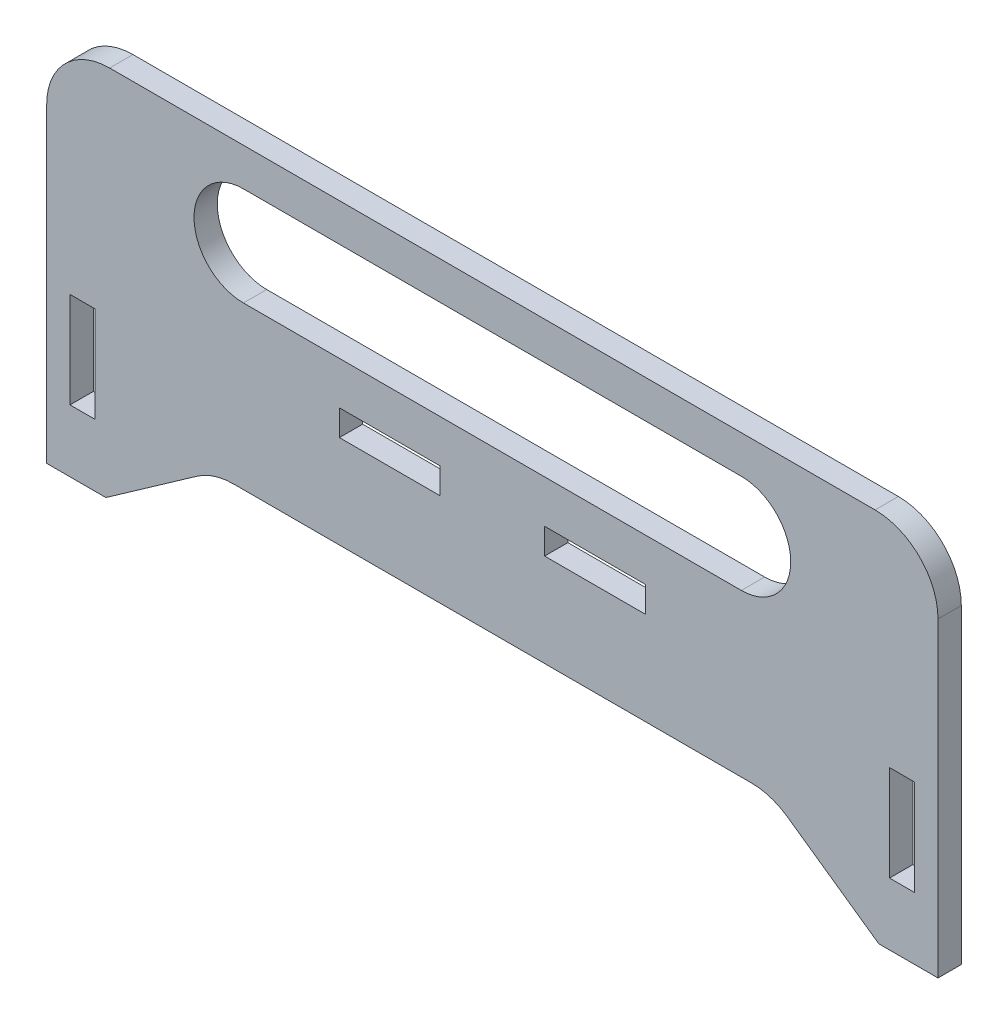
from build123d import *

# Parameters (mm, degrees)
SKETCH1_W           = 16
SKETCH1_H           = 4.1
SKETCH1_W_2         = 4
SKETCH1_H_2         = 15.2
BOSS_EXTRUDE2_DEPTH = 3.7
FILLET1_R           = 10
FILLET2_R           = 10


with BuildPart() as part:
    # Sketch1 → Boss-Extrude2 (new body)
    with BuildSketch(Plane.XY):
        Polygon((-110.178290248, 0), (31.421709752, 0), (31.421709752, -59.4), (22.021709752, -59.4), (4.921709752, -47.383344891), (-83.678290248, -47.383344891), (-100.778290248, -59.4), (-110.178290248, -59.4), align=None)
        with BuildLine():
            Line((0.171709752, -21.7), (-78.928290248, -21.7))
            ThreePointArc((-78.928290248, -21.7), (-86.778290248, -13.85), (-78.928290248, -6))
            Line((-78.928290248, -6), (0.171709752, -6))
            ThreePointArc((0.171709752, -6), (8.021709752, -13.85), (0.171709752, -21.7))
        make_face(mode=Mode.SUBTRACT)
        with Locations((-23.078290248, -30.55)):
            Rectangle(SKETCH1_W, SKETCH1_H, mode=Mode.SUBTRACT)
        with Locations((-55.678290248, -30.55)):
            Rectangle(SKETCH1_W, SKETCH1_H, mode=Mode.SUBTRACT)
        with Locations((25.721709752, -41.9)):
            Rectangle(SKETCH1_W_2, SKETCH1_H_2, mode=Mode.SUBTRACT)
        with Locations((-104.478290248, -41.9)):
            Rectangle(SKETCH1_W_2, SKETCH1_H_2, mode=Mode.SUBTRACT)
    extrude(amount=BOSS_EXTRUDE2_DEPTH)

    # Fillet1
    fillet1_edges = [part.edges().sort_by_distance(p)[0] for p in [
        (-110.178290248, 0, 1.85),
        (31.421709752, 0, 1.85),
    ]]
    fillet(fillet1_edges, radius=FILLET1_R)

    # Fillet2
    fillet2_edges = [part.edges().sort_by_distance(p)[0] for p in [
        (4.921709752, -47.383344891, 1.85),
        (-83.678290248, -47.383344891, 1.85),
    ]]
    fillet(fillet2_edges, radius=FILLET2_R)


solid = part.part
